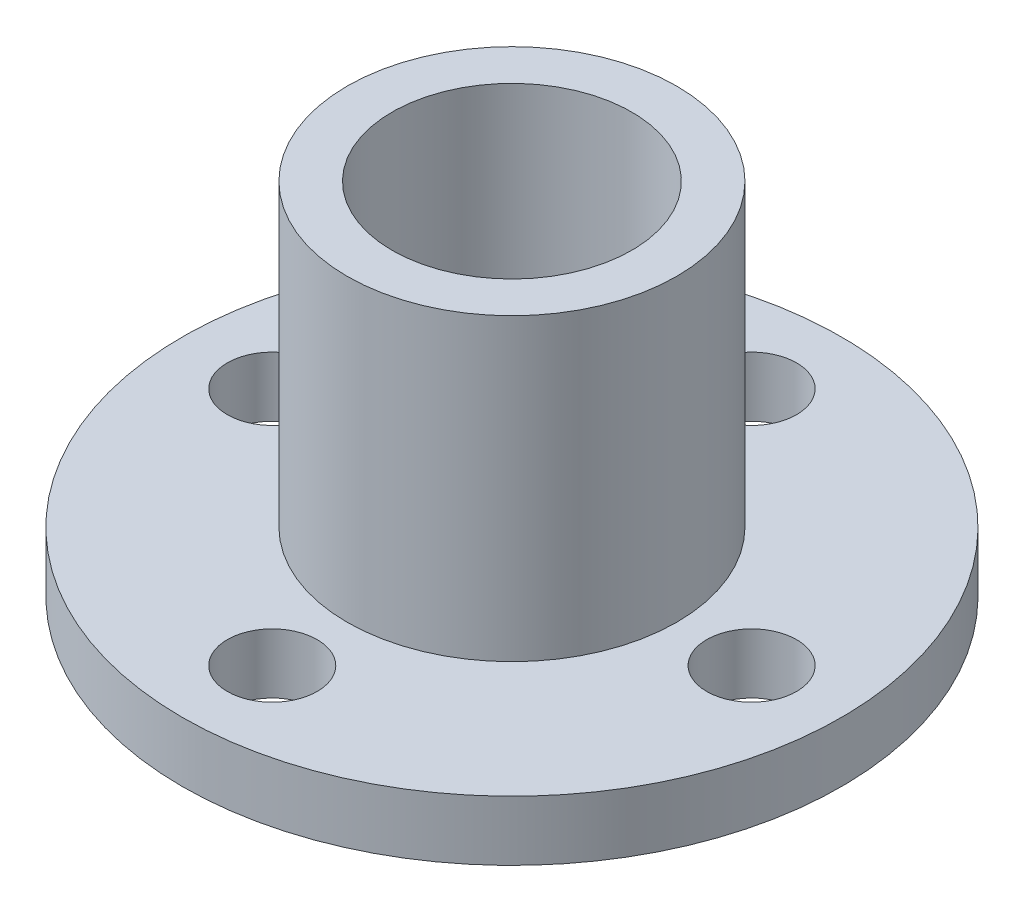
from build123d import *

# Parameters (mm, degrees)
SKETCH1_R           = 11
SKETCH1_R_2         = 4
BOSS_EXTRUDE1_DEPTH = 2
SKETCH2_R           = 1.5
CUT_EXTRUDE1_DEPTH  = 2
SKETCH3_R           = 5.5
SKETCH3_R_2         = 4
BOSS_EXTRUDE2_DEPTH = 10


with BuildPart() as part:
    # Sketch1 → Boss-Extrude1 (new body)
    with BuildSketch(Plane(origin=(0, 0, 0), x_dir=(1, 0, 0), z_dir=(0, 1, 0))):
        with Locations(Location((0, 0, 0), (0, 0, 270))):
            Circle(SKETCH1_R)
        with Locations(Location((0, 0, 0), (0, 0, 270))):
            Circle(SKETCH1_R_2, mode=Mode.SUBTRACT)
    extrude(amount=BOSS_EXTRUDE1_DEPTH)

    # Sketch2 → Cut-Extrude1 (cut)
    with BuildSketch(Plane(origin=(0, 2, 0), x_dir=(1, 0, 0), z_dir=(0, 1, 0))):
        with Locations(Location((8, 0, 0), (0, 0, 270))):
            Circle(SKETCH2_R)
        with Locations(Location((-8, 0, 0), (0, 0, 270))):
            Circle(SKETCH2_R)
        with Locations(Location((0, 8, 0), (0, 0, 270))):
            Circle(SKETCH2_R)
        with Locations(Location((0, -8, 0), (0, 0, 270))):
            Circle(SKETCH2_R)
    extrude(amount=-CUT_EXTRUDE1_DEPTH, mode=Mode.SUBTRACT)

    # Sketch3 → Boss-Extrude2 (add)
    with BuildSketch(Plane(origin=(0, 2, 0), x_dir=(1, 0, 0), z_dir=(0, 1, 0))):
        with Locations(Location((0, 0, 0), (0, 0, 270))):
            Circle(SKETCH3_R)
        with Locations(Location((0, 0, 0), (0, 0, 270))):
            Circle(SKETCH3_R_2, mode=Mode.SUBTRACT)
    extrude(amount=BOSS_EXTRUDE2_DEPTH)


solid = part.part
